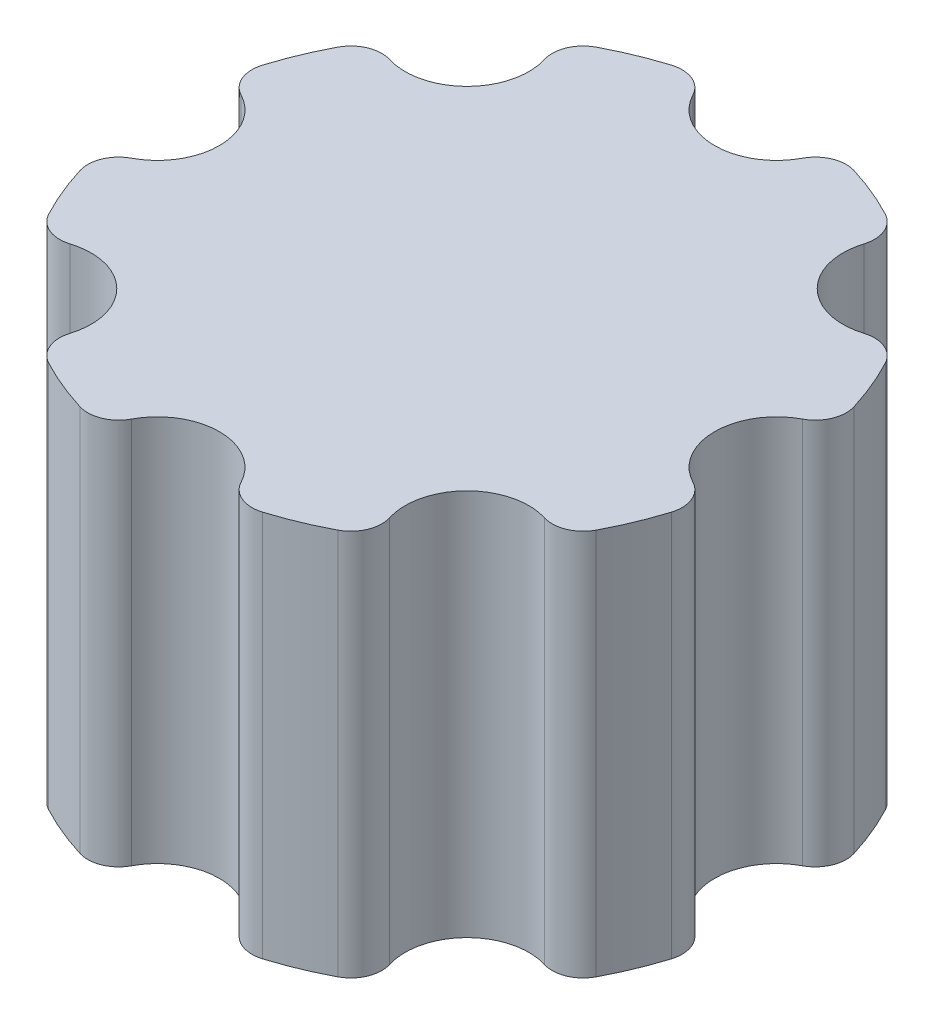
from build123d import *

# Parameters (mm, degrees)
SKETCH1_R           = 20
BOSS_EXTRUDE1_DEPTH = 25
SKETCH2_R           = 4
CUT_EXTRUDE1_DEPTH  = 25
FILLET1_R           = 2


with BuildPart() as part:
    # Sketch1 → Boss-Extrude1 (new body)
    with BuildSketch(Plane(origin=(0, 0, 0), x_dir=(1, 0, 0), z_dir=(0, 1, 0))):
        with Locations(Location((0, 0, 0), (0, 0, 270))):
            Circle(SKETCH1_R)
    extrude(amount=BOSS_EXTRUDE1_DEPTH)

    # Sketch2 → Cut-Extrude1 (cut)
    with BuildSketch(Plane(origin=(0, 25, 0), x_dir=(1, 0, 0), z_dir=(0, 1, 0))):
        with Locations((0, 20)):
            Circle(SKETCH2_R)
        with Locations((14.142135624, 14.142135624)):
            Circle(SKETCH2_R)
        with Locations((20, 0)):
            Circle(SKETCH2_R)
        with Locations((14.142135624, -14.142135624)):
            Circle(SKETCH2_R)
        with Locations((0, -20)):
            Circle(SKETCH2_R)
        with Locations((-14.142135624, -14.142135624)):
            Circle(SKETCH2_R)
        with Locations((-20, 0)):
            Circle(SKETCH2_R)
        with Locations((-14.142135624, 14.142135624)):
            Circle(SKETCH2_R)
    extrude(amount=-CUT_EXTRUDE1_DEPTH, mode=Mode.SUBTRACT)

    # Fillet1
    fillet1_edges = [part.edges().sort_by_distance(p)[0] for p in [
        (16.673542367, 12.5, -11.045043455),
        (11.045043455, 12.5, -16.673542367),
        (19.6, 12.5, 3.979949748),
        (19.6, 12.5, -3.979949748),
        (11.045043455, 12.5, 16.673542367),
        (16.673542367, 12.5, 11.045043455),
        (-3.979949748, 12.5, 19.6),
        (3.979949748, 12.5, 19.6),
        (-16.673542367, 12.5, 11.045043455),
        (-11.045043455, 12.5, 16.673542367),
        (-19.6, 12.5, -3.979949748),
        (-19.6, 12.5, 3.979949748),
        (-11.045043455, 12.5, -16.673542367),
        (-16.673542367, 12.5, -11.045043455),
        (3.979949748, 12.5, -19.6),
        (-3.979949748, 12.5, -19.6),
    ]]
    fillet(fillet1_edges, radius=FILLET1_R)


solid = part.part
